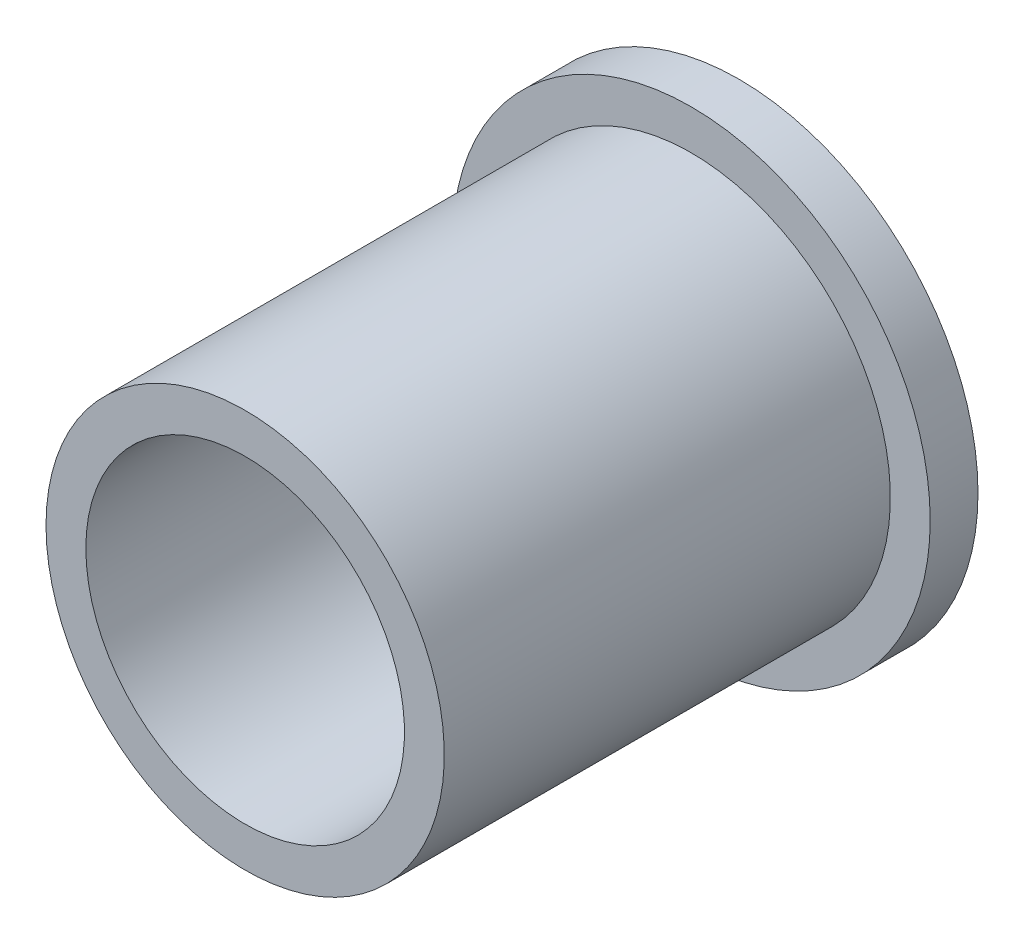
from build123d import *


with BuildPart() as part:
    # Sketch1 → Revolve1 (revolve)
    with BuildSketch(Plane(origin=(0, 0, 0), x_dir=(1, 0, 0), z_dir=(0, 1, 0)), mode=Mode.PRIVATE) as revolve1_sk:
        Polygon((10, 0), (10, -31), (12.5, -31), (12.5, -3), (15, -3), (15, 0), align=None)
    revolve(revolve1_sk.sketch.rotate(Axis((0, 0, 0), (0, 0, 1)), 180), axis=Axis((0, 0, 0), (0, 0, 1)))


solid = part.part
